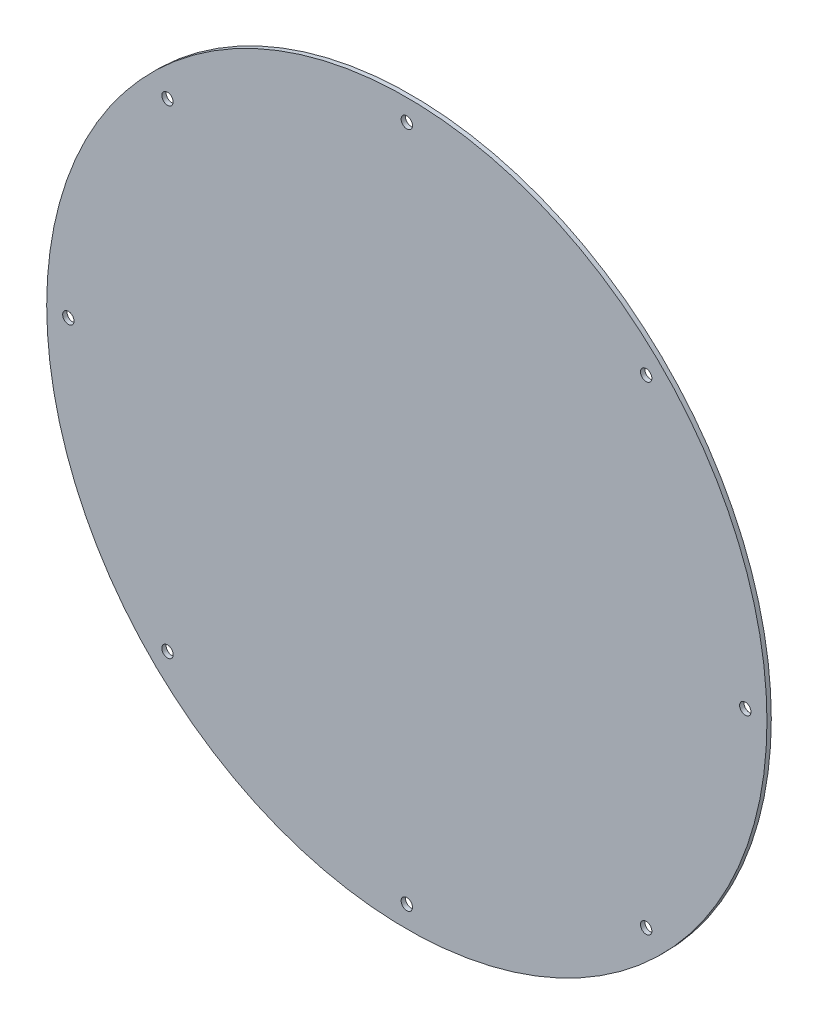
from build123d import *

# Parameters (mm, degrees)
SKETCH1_R           = 133
SKETCH1_R_2         = 2.1
BOSS_EXTRUDE2_DEPTH = 1.6


with BuildPart() as part:
    # Sketch1 → Boss-Extrude2 (new body)
    with BuildSketch(Plane.XY):
        Circle(SKETCH1_R)
        with Locations((0, 125)):
            Circle(SKETCH1_R_2, mode=Mode.SUBTRACT)
        with Locations((88.388347648, 88.388347648)):
            Circle(SKETCH1_R_2, mode=Mode.SUBTRACT)
        with Locations((125, 0)):
            Circle(SKETCH1_R_2, mode=Mode.SUBTRACT)
        with Locations((88.388347648, -88.388347648)):
            Circle(SKETCH1_R_2, mode=Mode.SUBTRACT)
        with Locations((0, -125)):
            Circle(SKETCH1_R_2, mode=Mode.SUBTRACT)
        with Locations((-88.388347648, -88.388347648)):
            Circle(SKETCH1_R_2, mode=Mode.SUBTRACT)
        with Locations((-125, 0)):
            Circle(SKETCH1_R_2, mode=Mode.SUBTRACT)
        with Locations((-88.388347648, 88.388347648)):
            Circle(SKETCH1_R_2, mode=Mode.SUBTRACT)
    extrude(amount=BOSS_EXTRUDE2_DEPTH)


solid = part.part
